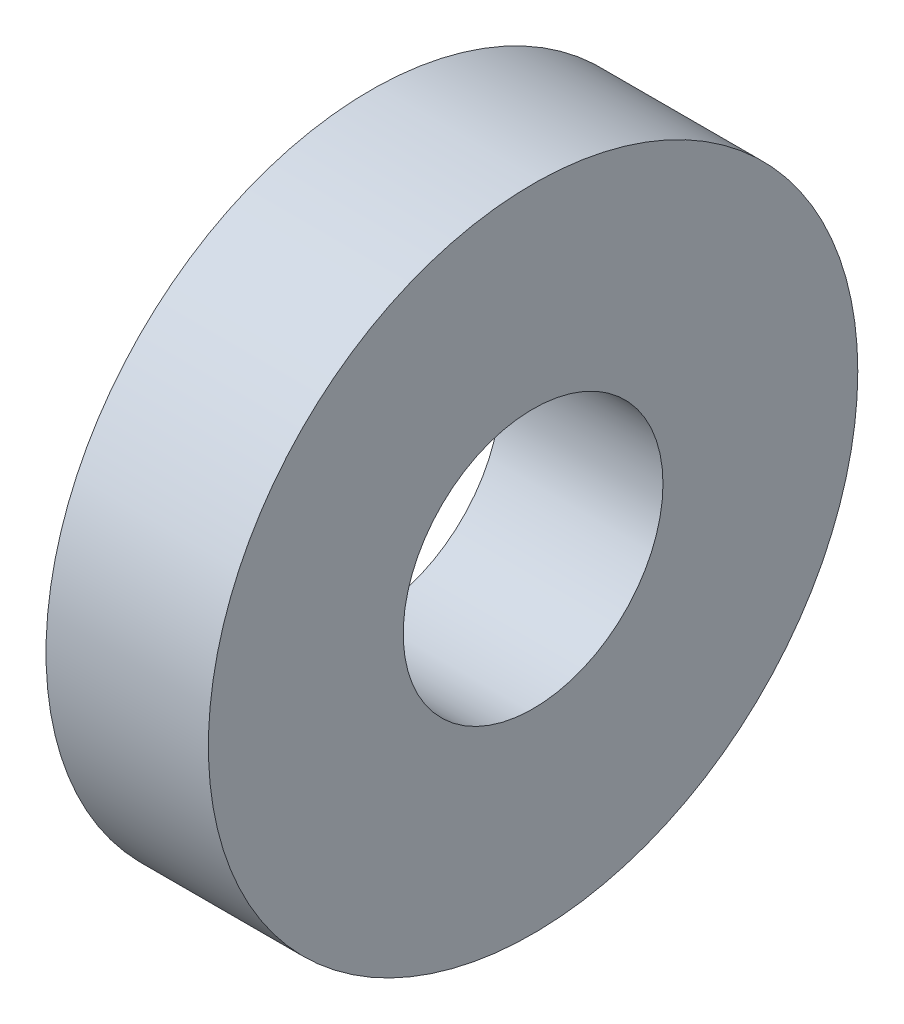
from build123d import *

# Parameters (mm, degrees)
SKETCH_1_R      = 10
SKETCH_1_R_2    = 4
EXTRUDE_1_DEPTH = 5


with BuildPart() as part:
    # Эскиз1 → Вытянуть1 (new body)
    with BuildSketch(Plane(origin=(0, 0, 0), x_dir=(0, 0, -1), z_dir=(1, 0, 0))):
        Circle(SKETCH_1_R)
        Circle(SKETCH_1_R_2, mode=Mode.SUBTRACT)
    extrude(amount=EXTRUDE_1_DEPTH)


solid = part.part
